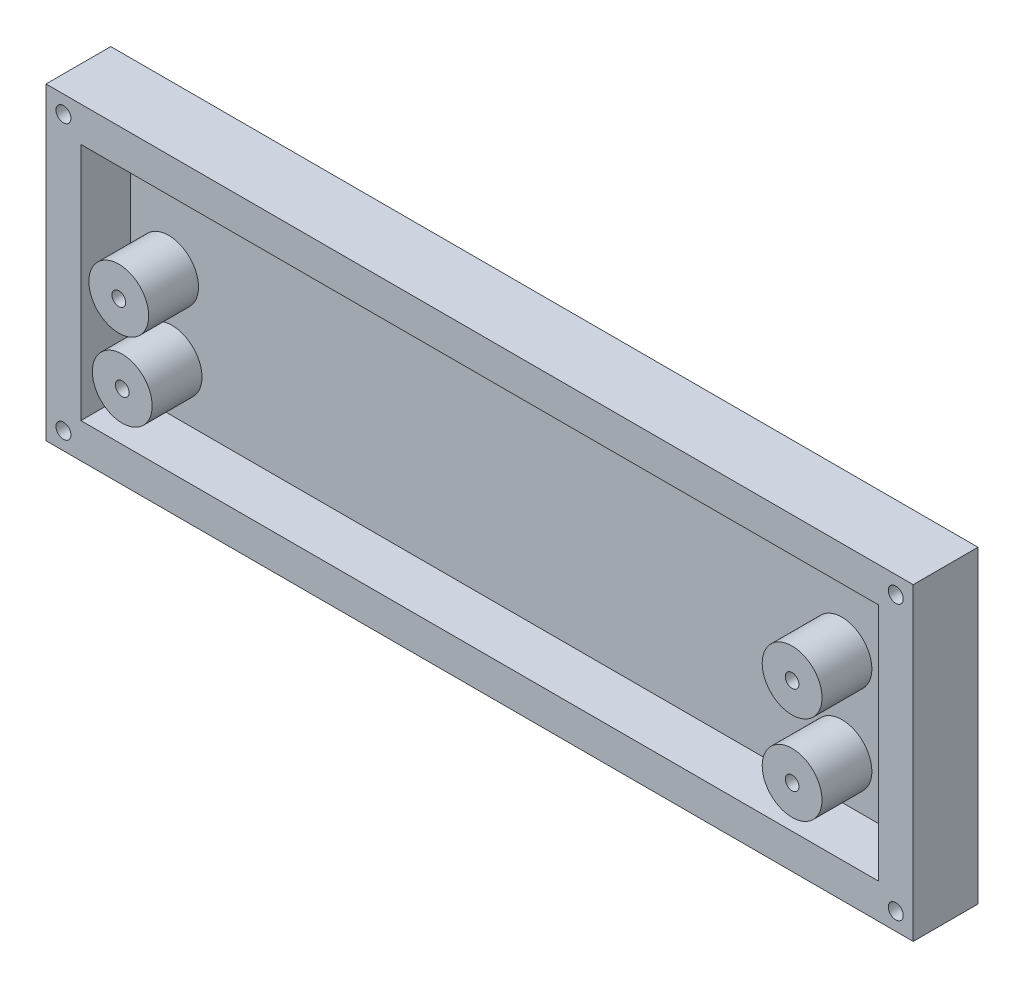
from build123d import *

# Parameters (mm, degrees)
SKICA1_W                      = 160
SKICA1_H                      = 48
P_IDAT_VYSUNUT_M1_DEPTH       = 3
SKICA3_R                      = 6
SKICA3_R_2                    = 1.375
STOJNY_K_PCB_DEPTH            = 13
SKICA5_W                      = 174
SKICA5_H                      = 62
SKICA5_W_2                    = 160
SKICA5_H_2                    = 48
P_IDAT_VYSUNUT_M3_DEPTH       = 13
ODEBRAT_VYSUNUT_M2_DEPTH      = 177.303715219
ODEBRAT_VYSUNUT_M2_DEPTH_BACK = 177.303715219
SKICA7_R                      = 1.5


with BuildPart() as part:
    # Skica1 → Přidat vysunutím1 (new body)
    with BuildSketch(Plane.XY):
        with Locations((80, 24)):
            Rectangle(SKICA1_W, SKICA1_H)
    extrude(amount=P_IDAT_VYSUNUT_M1_DEPTH)

    # Skica3 → stojny k PCB (add)
    # profile 1 of 4: a face of its own
    with BuildSketch(Plane(origin=(0, 0, 0), x_dir=(-1, 0, 0), z_dir=(0, 0, -1))):
        with Locations((-7.6, 25)):
            Circle(SKICA3_R)
        with Locations((-7.6, 25)):
            Circle(SKICA3_R_2, mode=Mode.SUBTRACT)
    # profile 2 of 4: a face of its own
    with BuildSketch(Plane(origin=(0, 0, 0), x_dir=(-1, 0, 0), z_dir=(0, 0, -1))):
        with Locations((-8.3, 9.7)):
            Circle(SKICA3_R)
        with Locations((-8.3, 9.7)):
            Circle(SKICA3_R_2, mode=Mode.SUBTRACT)
    # profile 3 of 4: a face of its own
    with BuildSketch(Plane(origin=(0, 0, 0), x_dir=(-1, 0, 0), z_dir=(0, 0, -1))):
        with Locations((-142.7, 26.2)):
            Circle(SKICA3_R)
        with Locations((-142.7, 26.2)):
            Circle(SKICA3_R_2, mode=Mode.SUBTRACT)
    # profile 4 of 4: a face of its own
    with BuildSketch(Plane(origin=(0, 0, 0), x_dir=(-1, 0, 0), z_dir=(0, 0, -1))):
        with Locations((-142.7, 8.4)):
            Circle(SKICA3_R)
        with Locations((-142.7, 8.4)):
            Circle(SKICA3_R_2, mode=Mode.SUBTRACT)
    extrude(amount=-STOJNY_K_PCB_DEPTH)

    # Skica5 → Přidat vysunutím3 (add)
    with BuildSketch(Plane(origin=(0, 0, 0), x_dir=(-1, 0, 0), z_dir=(0, 0, -1))):
        with Locations((-80, 24)):
            Rectangle(SKICA5_W, SKICA5_H)
        with Locations((-80, 24)):
            Rectangle(SKICA5_W_2, SKICA5_H_2, mode=Mode.SUBTRACT)
    extrude(amount=-P_IDAT_VYSUNUT_M3_DEPTH)

    # Skica7 → Odebrat vysunutím2 (cut, two sides: drawn at the far end of the back side and taken through both)
    with BuildSketch(Plane.XY.offset(13).offset(-ODEBRAT_VYSUNUT_M2_DEPTH_BACK)):
        with Locations((-3.5, -3.5)):
            Circle(SKICA7_R)
        with Locations((-3.5, 51.5)):
            Circle(SKICA7_R)
        with Locations((163.5, -3.5)):
            Circle(SKICA7_R)
        with Locations((163.5, 51.5)):
            Circle(SKICA7_R)
    extrude(amount=ODEBRAT_VYSUNUT_M2_DEPTH + ODEBRAT_VYSUNUT_M2_DEPTH_BACK, mode=Mode.SUBTRACT)


solid = part.part
